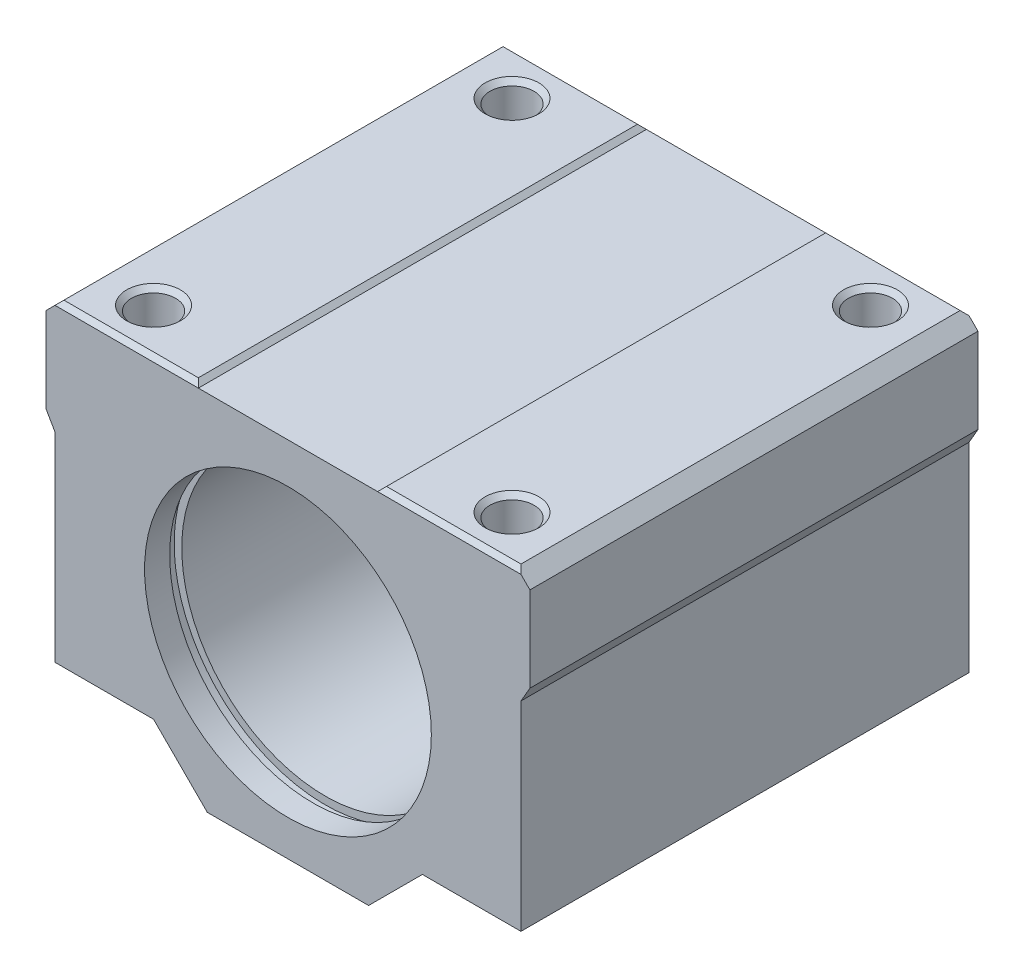
from build123d import *

# Parameters (mm, degrees)
EXTRUDE_1_DEPTH          = 50
CUT_EXTRUDE_1_DEPTH      = 27
CUT_EXTRUDE_1_DEPTH_BACK = 27
SKETCH_2_W               = 75
SKETCH_2_H               = 82


with BuildPart() as part:
    # 草图1 → 凸台-拉伸1 (new body)
    with BuildSketch(Plane.XY):
        Polygon((-27, 19.5), (-27, 10), (-26, 8.267949192), (-26, -14), (-15, -14), (-9, -20), (9, -20), (15, -14), (26, -14), (26, 8.267949192), (27, 10), (27, 19.5), (25.5, 21), (10.5, 21), (10, 20.5), (-10, 20.5), (-10.5, 21), (-25.5, 21), align=None)
    extrude(amount=EXTRUDE_1_DEPTH)

    # 草图2 → 切除-拉伸1 (cut, two sides: drawn at the far end of the back side and taken through both)
    with BuildSketch(Plane(origin=(0, 0, 0), x_dir=(0, 0, -1), z_dir=(1, 0, 0)).offset(-CUT_EXTRUDE_1_DEPTH_BACK)):
        with Locations((-25, 0)):
            Rectangle(SKETCH_2_W, SKETCH_2_H)
        Polygon((-50, -20), (0, -20), (0, 20.5), (-0.5, 21), (-49.5, 21), (-50, 20.5), align=None, mode=Mode.SUBTRACT)
    extrude(amount=CUT_EXTRUDE_1_DEPTH + CUT_EXTRUDE_1_DEPTH_BACK, mode=Mode.SUBTRACT)

    # 草图3 → 切除-旋转1 (revolve, cut)
    with BuildSketch(Plane(origin=(0, 0, 0), x_dir=(0, 0, -1), z_dir=(1, 0, 0))):
        Polygon((-50, 0), (-50, 16), (-47.2, 16), (-47.2, 16.85), (-45.85, 16.85), (-45.85, 16), (-4.15, 16), (-4.15, 16.85), (-2.8, 16.85), (-2.8, 16), (0, 16), (0, 0), align=None)
    revolve(axis=Axis((0, 0, 0), (0, 0, 1)), mode=Mode.SUBTRACT)

    # 草图4 → 切除-旋转2 (revolve, cut)
    with BuildSketch(Plane(origin=(20, 0, 0), x_dir=(0, 0, -1), z_dir=(1, 0, 0))):
        Polygon((-5, 21), (-2, 21), (-2.5415, 20.4585), (-2.5415, 9), (-2.4, 9), (-2.4, -13.5), (-2.111324865, -14), (-5, -14), align=None)
    revolve(axis=Axis((20, -14, 5), (0, 1, 0)), mode=Mode.SUBTRACT)

    # 草图5 → 切除-旋转3 (revolve, cut)
    with BuildSketch(Plane(origin=(20, 0, 0), x_dir=(0, 0, -1), z_dir=(1, 0, 0))):
        Polygon((-45, 21), (-42, 21), (-42.5415, 20.4585), (-42.5415, 9), (-42.4, 9), (-42.4, -13.5), (-42.111324865, -14), (-45, -14), align=None)
    revolve(axis=Axis((20, -14, 45), (0, 1, 0)), mode=Mode.SUBTRACT)

    # 草图6 → 切除-旋转4 (revolve, cut)
    with BuildSketch(Plane(origin=(-20, 0, 0), x_dir=(0, 0, -1), z_dir=(1, 0, 0))):
        Polygon((-5, 21), (-2, 21), (-2.5415, 20.4585), (-2.5415, 9), (-2.4, 9), (-2.4, -13.5), (-2.111324865, -14), (-5, -14), align=None)
    revolve(axis=Axis((-20, -14, 5), (0, 1, 0)), mode=Mode.SUBTRACT)

    # 草图7 → 切除-旋转5 (revolve, cut)
    with BuildSketch(Plane(origin=(-20, 0, 0), x_dir=(0, 0, -1), z_dir=(1, 0, 0))):
        Polygon((-45, 21), (-42, 21), (-42.5415, 20.4585), (-42.5415, 9), (-42.4, 9), (-42.4, -13.5), (-42.111324865, -14), (-45, -14), align=None)
    revolve(axis=Axis((-20, -14, 45), (0, 1, 0)), mode=Mode.SUBTRACT)


solid = part.part
